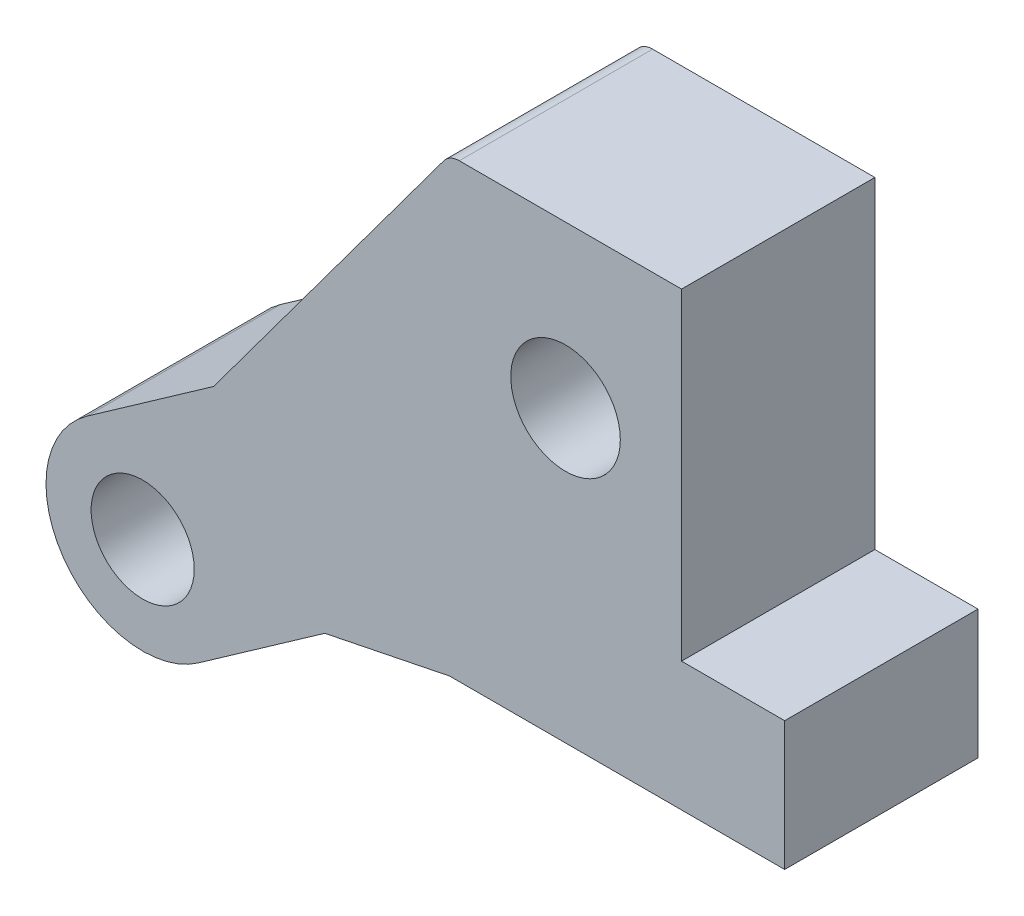
from build123d import *

# Parameters (mm, degrees)
SKETCH2_R           = 4.25
SKETCH2_R_2         = 4
BOSS_EXTRUDE1_DEPTH = 15
FILLET1_R           = 1.5


with BuildPart() as part:
    # Sketch2 → Boss-Extrude1 (new body)
    with BuildSketch(Plane.XY):
        with BuildLine():
            Line((0, -35), (26, -35))
            Line((26, -35), (26, -25))
            Line((26, -25), (18, -25))
            Line((18, -25), (18, 0))
            Line((18, 0), (0, 0))
            Line((0, 0), (-18.303795088, -24.696911327))
            Line((-18.303795088, -24.696911327), (-28.121591697, -31.596974351))
            ThreePointArc((-28.121591697, -31.596974351), (-29.945175188, -42.045636622), (-19.496512917, -43.869220113))
            Line((-19.496512917, -43.869220113), (-9.678716308, -36.969157088))
            Line((-9.678716308, -36.969157088), (0, -35))
        make_face()
        with Locations((9, -12.5)):
            Circle(SKETCH2_R, mode=Mode.SUBTRACT)
        with Locations((-23.809052307, -37.733097232)):
            Circle(SKETCH2_R_2, mode=Mode.SUBTRACT)
    extrude(amount=BOSS_EXTRUDE1_DEPTH)

    # Fillet1
    fillet1_edges = [part.edges().sort_by_distance(p)[0] for p in [
        (0, 0, 7.5),
    ]]
    fillet(fillet1_edges, radius=FILLET1_R)


solid = part.part
